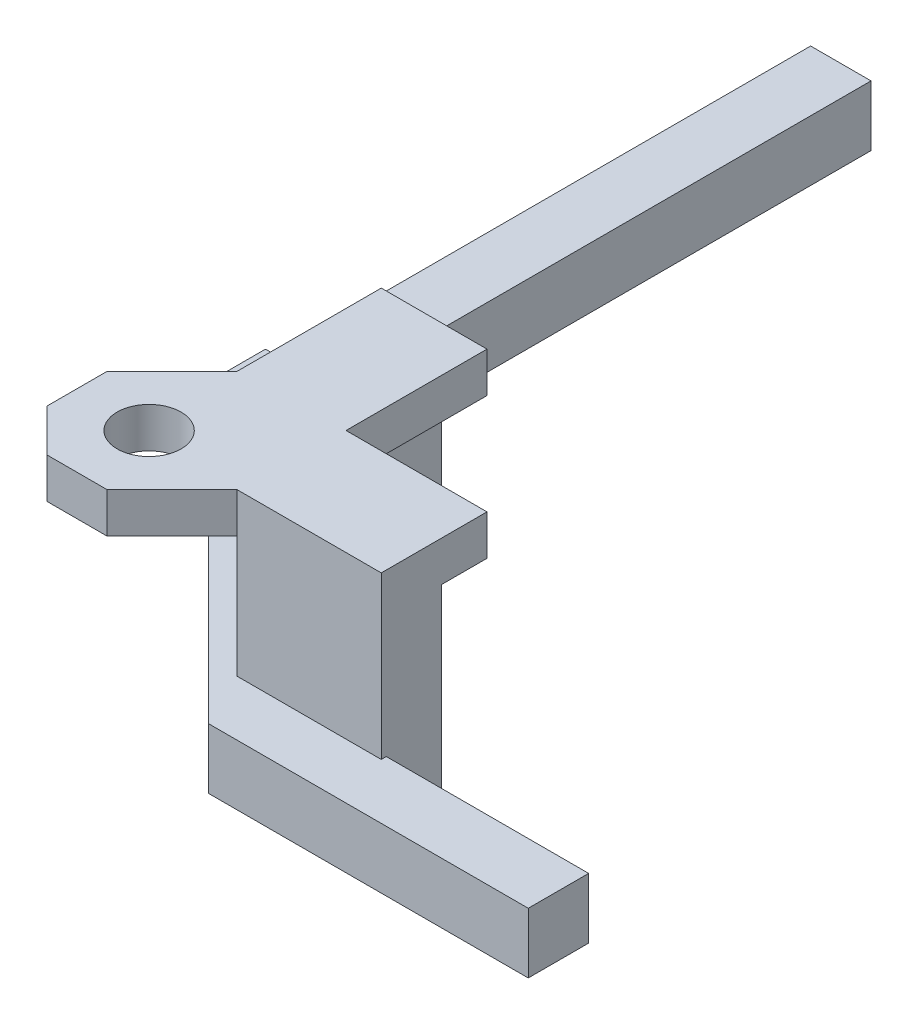
from build123d import *

# Parameters (mm, degrees)
BOSS_EXTRUDE1_DEPTH            = 6
BOSS_EXTRUDE2_DEPTH            = 1
BOSS_EXTRUDE3_DEPTH            = 12.05
SKETCH4_R                      = 3.175
BOSS_EXTRUDE4_DEPTH            = 4
CUT_EXTRUDE1_REACH             = 87.707
SKETCH5_W                      = 14.384776311
SKETCH5_H                      = 8
CUT_EXTRUDE1_DIRECTION_2_DEPTH = 86.707273439


with BuildPart() as part:
    # Sketch1 → Boss-Extrude1 (new body)
    with BuildSketch(Plane(origin=(0, 0, 0), x_dir=(1, 0, 0), z_dir=(0, 1, 0))):
        Polygon((-54.15, 0), (-60.15, 0), (-60.15, -53.15), (-61.15, -53.15), (-61.15, -61.15), (-58.806854249, -61.15), (-31.756854249, -88.2), (0, -88.2), (0, -82.2), (-20.1, -82.2), (-20.1, -76.7), (-31.943145751, -76.7), (-38.6, -70.043145751), (-38.6, -58.2), (-53.15, -58.2), (-53.15, -53.15), (-54.15, -53.15), align=None)
    extrude(amount=BOSS_EXTRUDE1_DEPTH)

    # Sketch2 → Boss-Extrude2 (add)
    with BuildSketch(Plane.XZ):
        Polygon((-53.15, 58.2), (-53.15, 53.15), (-61.15, 53.15), (-61.15, 61.15), (-53.15, 61.15), align=None)
    extrude(amount=BOSS_EXTRUDE2_DEPTH)

    # Sketch3 → Boss-Extrude3 (add)
    with BuildSketch(Plane(origin=(0, 6, 0), x_dir=(1, 0, 0), z_dir=(0, 1, 0))):
        Polygon((-38.6, -58.2), (-44.6, -58.2), (-44.6, -72.528427125), (-34.428427125, -82.7), (-20.1, -82.7), (-20.1, -76.7), (-31.943145751, -76.7), (-38.6, -70.043145751), align=None)
    extrude(amount=BOSS_EXTRUDE3_DEPTH)

    # Sketch4 → Boss-Extrude4 (add)
    with BuildSketch(Plane(origin=(0, 18.05, 0), x_dir=(1, 0, 0), z_dir=(0, 1, 0))):
        Polygon((-44.6, -58.2), (-34.1, -58.2), (-34.1, -72.2), (-20.1, -72.2), (-20.1, -82.7), (-34.45301769, -82.7), (-40.908615626, -89.155597936), (-46.852580246, -89.155597936), (-51.055597936, -84.952580246), (-51.055597936, -79.008615626), (-44.6, -72.55301769), align=None)
        with Locations(Location((-43.880597936, -81.980597936, 0), (0, 0, 270))):
            Circle(SKETCH4_R, mode=Mode.SUBTRACT)
    extrude(amount=BOSS_EXTRUDE4_DEPTH)

    # Sketch5 → Cut-Extrude1 (cut, up to next)
    with BuildSketch(Plane(origin=(-58.564213562, 0, 58.564213562), x_dir=(0.7071067811865475, 0, 0.7071067811865477), z_dir=(-0.7071067811865477, 0, 0.7071067811865475)), mode=Mode.PRIVATE) as cut_extrude1_sk1:
        with Locations((26.940768364, 14.05)):
            Rectangle(SKETCH5_W, SKETCH5_H)
    cut_extrude1_tool1 = extrude(cut_extrude1_sk1.sketch, amount=-CUT_EXTRUDE1_REACH, mode=Mode.PRIVATE) & part.part
    add(cut_extrude1_tool1.solids().sort_by_distance((-39.514214, 14.05, 77.614214))[0], mode=Mode.SUBTRACT)

    # Sketch5 → Cut-Extrude1 direction 2 (cut)
    with BuildSketch(Plane(origin=(-58.564213562, 0, 58.564213562), x_dir=(0.7071067811865475, 0, 0.7071067811865477), z_dir=(-0.7071067811865477, 0, 0.7071067811865475))):
        with Locations((26.940768364, 14.05)):
            Rectangle(SKETCH5_W, SKETCH5_H)
    extrude(amount=CUT_EXTRUDE1_DIRECTION_2_DEPTH, mode=Mode.SUBTRACT)


solid = part.part
